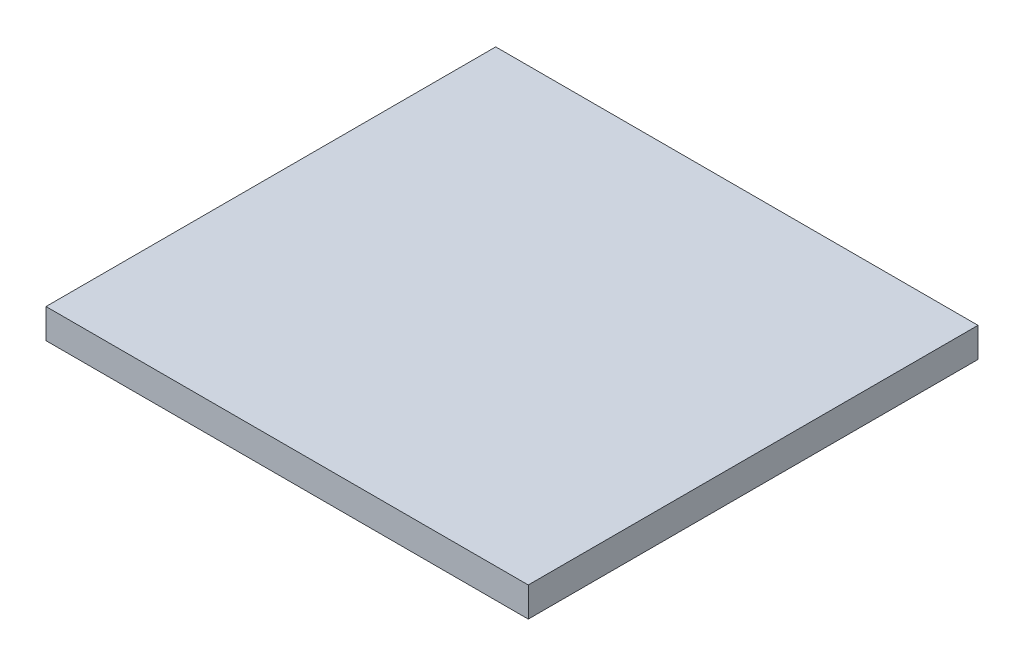
from build123d import *

# Parameters (mm, degrees)
SKIZZE1_W                       = 16.3
SKIZZE1_H                       = 15.2
AUFSATZ_LINEAR_AUSTRAGEN1_DEPTH = 1


with BuildPart() as part:
    # Skizze1 → Aufsatz-Linear austragen1 (new body)
    with BuildSketch(Plane(origin=(0, 0, 0), x_dir=(1, 0, 0), z_dir=(0, 1, 0))):
        Rectangle(SKIZZE1_W, SKIZZE1_H)
    extrude(amount=AUFSATZ_LINEAR_AUSTRAGEN1_DEPTH)


solid = part.part
